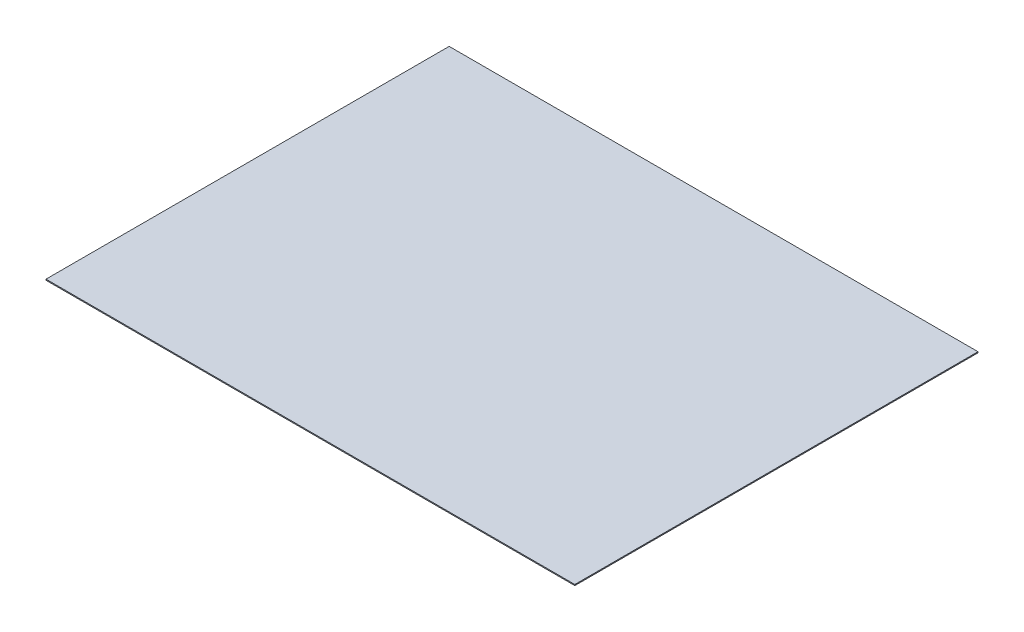
from build123d import *

# Parameters (mm, degrees)
CROQUIS1_W              = 1519.3
CROQUIS1_H              = 1158.2
SALIENTE_EXTRUIR1_DEPTH = 2.9


with BuildPart() as part:
    # Croquis1 → Saliente-Extruir1 (new body)
    with BuildSketch(Plane(origin=(0, 0, 0), x_dir=(1, 0, 0), z_dir=(0, 1, 0))):
        with Locations((759.65, -579.1)):
            Rectangle(CROQUIS1_W, CROQUIS1_H)
    extrude(amount=SALIENTE_EXTRUIR1_DEPTH)


solid = part.part
